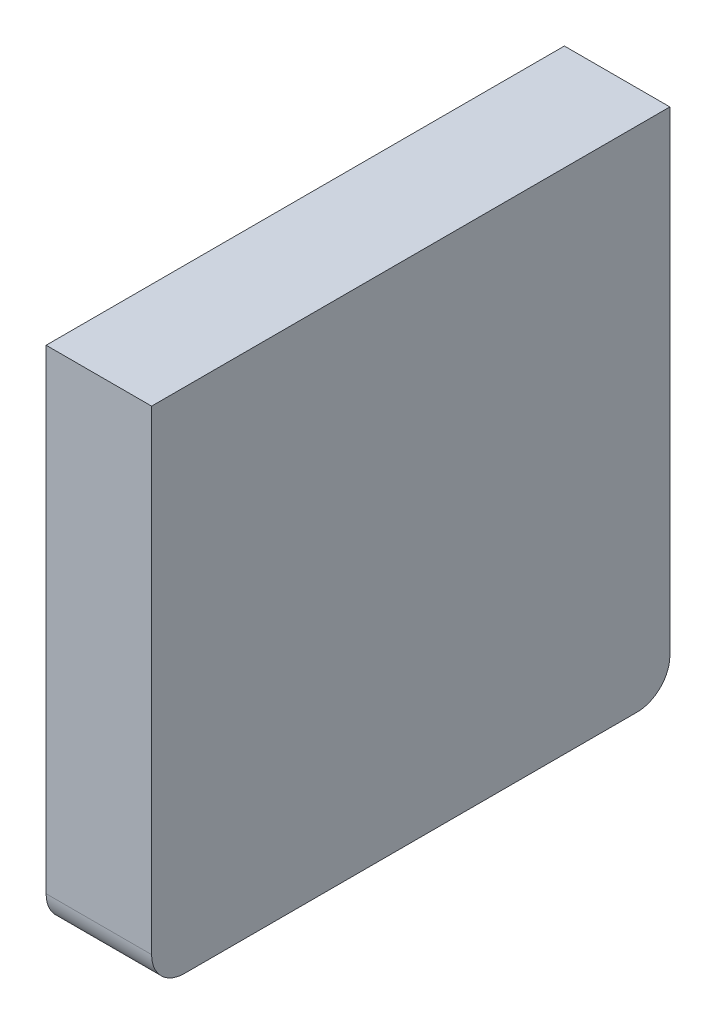
from build123d import *

# Parameters (mm, degrees)
SKETCH2_W           = 163.576
SKETCH2_H           = 787.4
BOSS_EXTRUDE1_DEPTH = 803.656
FILLET1_R           = 50.8


with BuildPart() as part:
    # Sketch2 → Boss-Extrude1 (new body)
    with BuildSketch(Plane.XY):
        with Locations((81.788, 393.7)):
            Rectangle(SKETCH2_W, SKETCH2_H)
    extrude(amount=BOSS_EXTRUDE1_DEPTH)

    # Fillet1
    fillet1_edges = [part.edges().sort_by_distance(p)[0] for p in [
        (81.788, 0, 0),
        (81.788, 0, 803.656),
    ]]
    fillet(fillet1_edges, radius=FILLET1_R)


solid = part.part
